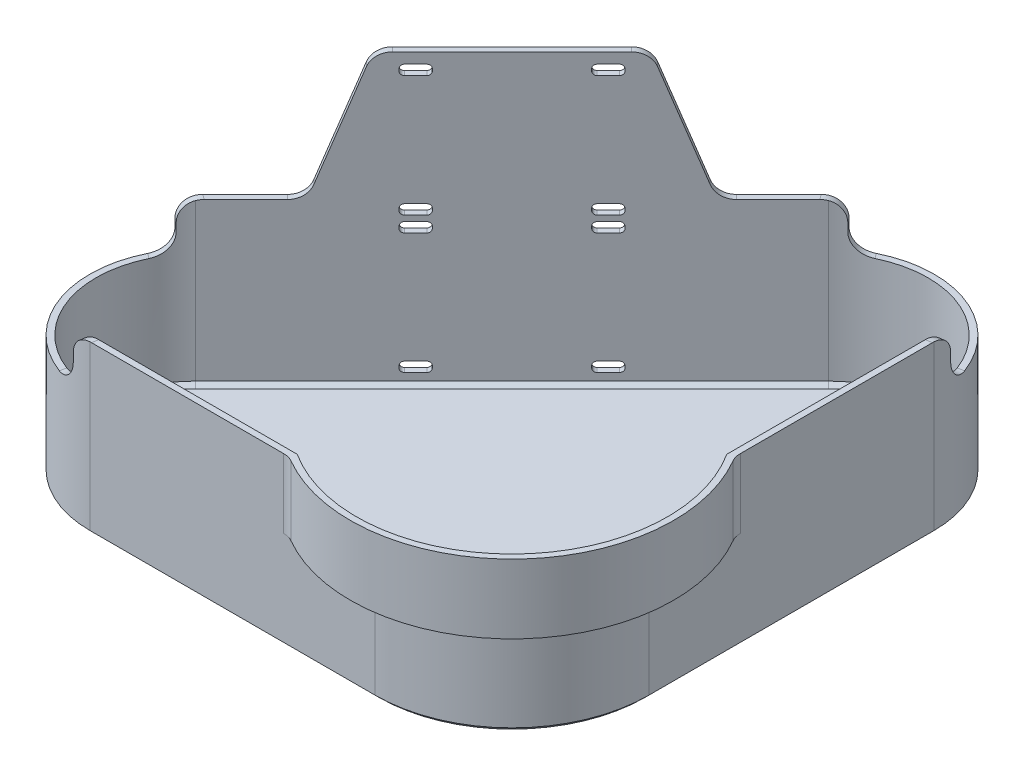
from build123d import *

# Parameters (mm, degrees)
BASE_EXTRUDE_R      = 2.15265
BOSS_EXTRUDE1_DEPTH = 2.000000064
EXTRUDE_THIN1_DEPTH = 31.75
BOSS_EXTRUDE2_START = -2.000000064
BOSS_EXTRUDE2_DEPTH = 2.000000064
EXTRUDE_THIN2_DEPTH = 20.32
WRAP1_SECTION_W     = 2
WRAP1_SECTION_H     = 15.24
WRAP1_ANGLE         = 117.312331459
BOSS_EXTRUDE3_DEPTH = 2.000000064
FILLET1_R           = 6.35
CHAMFER1_SIZE       = 1.27
CUT_EXTRUDE2_REACH  = 193.327
SKETCH10_W          = 7.62
SKETCH10_H          = 3.175
FILLET2_R           = 1.27


with BuildPart() as part:
    # Base Extrude → Boss-Extrude1 (new body)
    with BuildSketch(Plane(origin=(0, 0, 0), x_dir=(1, 0, 0), z_dir=(0, 1, 0))):
        with BuildLine():
            Line((3.000000096, 41.275), (3.000000096, 133.35))
            ThreePointArc((3.000000096, 133.35), (-18.059754668, 164.86815034), (-55.237947908, 157.472947908))
            Line((-55.237947908, 157.472947908), (-157.472947908, 55.237947908))
            ThreePointArc((-157.472947908, 55.237947908), (-164.86815034, 18.059754668), (-133.35, -3.000000096))
            Line((-133.35, -3.000000096), (-41.275, -3.000000096))
            ThreePointArc((-41.275, -3.000000096), (-9.967847195, 9.967847195), (3.000000096, 41.275))
        make_face()
        with Locations(Location((-55.570521066, 30.714596432, 0), (0, 0, 270))):
            Circle(BASE_EXTRUDE_R, mode=Mode.SUBTRACT)
        with Locations(Location((-30.714596432, 30.714596432, 0), (0, 0, 270))):
            Circle(BASE_EXTRUDE_R, mode=Mode.SUBTRACT)
        with Locations(Location((-30.714596432, 55.570521066, 0), (0, 0, 270))):
            Circle(BASE_EXTRUDE_R, mode=Mode.SUBTRACT)
    extrude(amount=BOSS_EXTRUDE1_DEPTH)

    # Sketch3 → Extrude-Thin1 (add)
    with BuildSketch(Plane(origin=(0, 2.000000064, 0), x_dir=(1, 0, 0), z_dir=(0, 1, 0))):
        with BuildLine():
            Line((-55.237947908, 157.472947908), (-157.472947908, 55.237947908))
            ThreePointArc((-157.472947908, 55.237947908), (-164.86815034, 18.059754668), (-133.35, -3.000000096))
            Line((-133.35, -3.000000096), (-41.275, -3.000000096))
            ThreePointArc((-41.275, -3.000000096), (-9.967847195, 9.967847195), (3.000000096, 41.275))
            Line((3.000000096, 41.275), (3.000000096, 133.35))
            ThreePointArc((3.000000096, 133.35), (-18.059754668, 164.86815034), (-55.237947908, 157.472947908))
        make_face()
        with BuildLine():
            Line((-53.8237343, 156.0587343), (-156.0587343, 53.8237343))
            ThreePointArc((-156.0587343, 53.8237343), (-163.020391216, 18.825121557), (-133.35, -1.000000032))
            Line((-133.35, -1.000000032), (-41.275, -1.000000032))
            ThreePointArc((-41.275, -1.000000032), (-11.382060803, 11.382060803), (1.000000032, 41.275))
            Line((1.000000032, 41.275), (1.000000032, 133.35))
            ThreePointArc((1.000000032, 133.35), (-18.825121557, 163.020391216), (-53.8237343, 156.0587343))
        make_face(mode=Mode.SUBTRACT)
    extrude(amount=EXTRUDE_THIN1_DEPTH)

    # Sketch4 → Boss-Extrude2 (add)
    with BuildSketch(Plane(origin=(0, 33.750000064, 0), x_dir=(1, 0, 0), z_dir=(0, 1, 0)).offset(BOSS_EXTRUDE2_START)):
        with BuildLine():
            Line((-41.275, -3.000000096), (-64.960850754, -3.000000096))
            ThreePointArc((-64.960850754, -3.000000096), (-5.769400727, 5.769400727), (3.000000096, 64.960850754))
            Line((3.000000096, 64.960850754), (3.000000096, 41.275))
            ThreePointArc((3.000000096, 41.275), (-9.967847195, 9.967847195), (-41.275, -3.000000096))
        make_face()
        with BuildLine():
            Line((-64.960850754, -3.000000096), (-68.94934792, -3.000000096))
            ThreePointArc((-68.94934792, -3.000000096), (-4.355187119, 4.355187119), (3.000000096, 68.94934792))
            Line((3.000000096, 68.94934792), (3.000000096, 64.960850754))
            ThreePointArc((3.000000096, 64.960850754), (-5.769400727, 5.769400727), (-64.960850754, -3.000000096))
        make_face()
    extrude(amount=BOSS_EXTRUDE2_DEPTH)

    # Sketch5 → Extrude-Thin2 (add)
    with BuildSketch(Plane(origin=(0, 33.750000064, 0), x_dir=(1, 0, 0), z_dir=(0, 1, 0))):
        with BuildLine():
            Line((-55.237947908, 157.472947908), (-157.472947908, 55.237947908))
            ThreePointArc((-157.472947908, 55.237947908), (-164.86815034, 18.059754668), (-133.35, -3.000000096))
            Line((-133.35, -3.000000096), (-68.94934792, -3.000000096))
            ThreePointArc((-68.94934792, -3.000000096), (-4.355187119, 4.355187119), (3.000000096, 68.94934792))
            Line((3.000000096, 68.94934792), (3.000000096, 133.35))
            ThreePointArc((3.000000096, 133.35), (-18.059754668, 164.86815034), (-55.237947908, 157.472947908))
        make_face()
        with BuildLine():
            Line((-53.8237343, 156.0587343), (-156.0587343, 53.8237343))
            ThreePointArc((-156.0587343, 53.8237343), (-163.020391216, 18.825121557), (-133.35, -1.000000032))
            Line((-133.35, -1.000000032), (-68.369640277, -1.000000032))
            ThreePointArc((-68.369640277, -1.000000032), (-5.769400727, 5.769400727), (1.000000032, 68.369640277))
            Line((1.000000032, 68.369640277), (1.000000032, 133.35))
            ThreePointArc((1.000000032, 133.35), (-18.825121557, 163.020391216), (-53.8237343, 156.0587343))
        make_face(mode=Mode.SUBTRACT)
    extrude(amount=EXTRUDE_THIN2_DEPTH)

    # Wrap1 section (on wrap section) → Wrap1 (revolve, cut)
    with BuildSketch(Plane(origin=(-133.35, 0, -31.115), x_dir=(-0.170521550427512, 0, 0.9853539469854462), z_dir=(0.9853539469854462, 0, 0.170521550427512))):
        with Locations((33.115000096, -46.4500001)):
            Rectangle(WRAP1_SECTION_W, WRAP1_SECTION_H)
    revolve(axis=Axis((-133.35, 0, -31.115), (0, -1, 0)), revolution_arc=WRAP1_ANGLE, mode=Mode.SUBTRACT)

    # SurfaceCut1
    split(bisect_by=Plane(origin=(0, 0, 0), x_dir=(-0.7071067811865477, 0, -0.7071067811865475), z_dir=(0.7071067811865475, 0, -0.7071067811865477)), keep=Keep.BOTTOM)

    # Mirror6: part across plane


with BuildPart() as part_1:
    add(part.part)
    add(part.part.mirror(Plane(origin=(0, 0, 0), x_dir=(0.7071067811865478, 0, 0.7071067811865472), z_dir=(0.7071067811865475, 0, -0.7071067811865477))))

    # Sketch9 → Boss-Extrude3 (add)
    with BuildSketch(Plane(origin=(-106.355447908, 0, -106.355447908), x_dir=(-0.7071067811865475, 0, 0.7071067811865477), z_dir=(-0.7071067811865477, 0, -0.7071067811865475))):
        Polygon((0, 54.070000064), (46.772871419, 54.070000064), (31.75, 95.345000064), (0, 95.345000064), align=None)
        Polygon((-46.772871419, 54.070000064), (0, 54.070000064), (0, 95.345000064), (-31.75, 95.345000064), align=None)
    extrude(amount=-BOSS_EXTRUDE3_DEPTH)

    # Fillet1
    fillet1_edges = [part_1.edges().sort_by_distance(p)[0] for p in [
        (-138.996821159, 54.0700001, 1.514996049),
        (-159.75136321, 54.0700001, -51.104278427),
        (-159.75136321, 38.8300001, -51.104278427),
        (-138.996821159, 38.8300001, 1.514996049),
        (3.000000096, 42.910000032, -68.94934792),
        (-51.104278427, 54.0700001, -159.75136321),
        (1.514996049, 54.0700001, -138.996821159),
        (-51.104278427, 38.8300001, -159.75136321),
        (1.514996049, 38.8300001, -138.996821159),
        (-83.197700802, 95.345000064, -128.098981407),
        (-128.098981407, 95.345000064, -83.197700802),
        (-138.72175566, 54.070000064, -72.574926548),
        (-72.574926548, 54.070000064, -138.72175566),
        (-68.94934792, 42.910000032, 3.000000096),
    ]]
    fillet(fillet1_edges, radius=FILLET1_R)

    # Chamfer1
    chamfer1_edges = [part_1.edges().sort_by_distance(p)[0] for p in [
        (-104.9412343, 2.000000064, -104.9412343),
        (-106.355447908, 0, -106.355447908),
        (-18.059754668, 0, -164.86815034),
        (3.000000096, 0, -87.3125),
        (-18.825121557, 2.000000064, -163.020391216),
        (1.000000032, 2.000000064, -87.3125),
        (-163.020391216, 2.000000064, -18.825121557),
        (-87.3125, 2.000000064, 1.000000032),
        (-11.382060803, 2.000000064, -11.382060803),
        (-9.967847195, 0, -9.967847195),
        (-87.3125, 0, 3.000000096),
        (-164.86815034, 0, -18.059754668),
    ]]
    chamfer(chamfer1_edges, length=CHAMFER1_SIZE)

    # Sketch10 → Cut-Extrude2 (cut, up to next)
    with BuildSketch(Plane(origin=(-106.355447908, 0, -106.355447908), x_dir=(-0.7071067811865475, 0, 0.7071067811865477), z_dir=(-0.7071067811865477, 0, -0.7071067811865475)), mode=Mode.PRIVATE) as cut_extrude2_sk1:
        with Locations((22, 7.26773328)):
            Rectangle(SKETCH10_W, SKETCH10_H)
    cut_extrude2_tool1 = extrude(cut_extrude2_sk1.sketch, amount=-CUT_EXTRUDE2_REACH, mode=Mode.PRIVATE) & part_1.part
    # Sketch10 → Cut-Extrude2 (cut, up to next)
    with BuildSketch(Plane(origin=(-106.355447908, 0, -106.355447908), x_dir=(-0.7071067811865475, 0, 0.7071067811865477), z_dir=(-0.7071067811865477, 0, -0.7071067811865475)), mode=Mode.PRIVATE) as cut_extrude2_sk2:
        with Locations((-22, 7.26773328)):
            Rectangle(SKETCH10_W, SKETCH10_H)
    cut_extrude2_tool2 = extrude(cut_extrude2_sk2.sketch, amount=-CUT_EXTRUDE2_REACH, mode=Mode.PRIVATE) & part_1.part
    # Sketch10 → Cut-Extrude2 (cut, up to next)
    with BuildSketch(Plane(origin=(-106.355447908, 0, -106.355447908), x_dir=(-0.7071067811865475, 0, 0.7071067811865477), z_dir=(-0.7071067811865477, 0, -0.7071067811865475)), mode=Mode.PRIVATE) as cut_extrude2_sk3:
        with Locations((-22, 46.28226672)):
            Rectangle(SKETCH10_W, SKETCH10_H)
    cut_extrude2_tool3 = extrude(cut_extrude2_sk3.sketch, amount=-CUT_EXTRUDE2_REACH, mode=Mode.PRIVATE) & part_1.part
    # Sketch10 → Cut-Extrude2 (cut, up to next)
    with BuildSketch(Plane(origin=(-106.355447908, 0, -106.355447908), x_dir=(-0.7071067811865475, 0, 0.7071067811865477), z_dir=(-0.7071067811865477, 0, -0.7071067811865475)), mode=Mode.PRIVATE) as cut_extrude2_sk4:
        with Locations((22, 46.28226672)):
            Rectangle(SKETCH10_W, SKETCH10_H)
    cut_extrude2_tool4 = extrude(cut_extrude2_sk4.sketch, amount=-CUT_EXTRUDE2_REACH, mode=Mode.PRIVATE) & part_1.part
    # Sketch10 → Cut-Extrude2 (cut, up to next)
    with BuildSketch(Plane(origin=(-106.355447908, 0, -106.355447908), x_dir=(-0.7071067811865475, 0, 0.7071067811865477), z_dir=(-0.7071067811865477, 0, -0.7071067811865475)), mode=Mode.PRIVATE) as cut_extrude2_sk5:
        with Locations((22, 51.29273328)):
            Rectangle(SKETCH10_W, SKETCH10_H)
    cut_extrude2_tool5 = extrude(cut_extrude2_sk5.sketch, amount=-CUT_EXTRUDE2_REACH, mode=Mode.PRIVATE) & part_1.part
    # Sketch10 → Cut-Extrude2 (cut, up to next)
    with BuildSketch(Plane(origin=(-106.355447908, 0, -106.355447908), x_dir=(-0.7071067811865475, 0, 0.7071067811865477), z_dir=(-0.7071067811865477, 0, -0.7071067811865475)), mode=Mode.PRIVATE) as cut_extrude2_sk6:
        with Locations((-22, 51.29273328)):
            Rectangle(SKETCH10_W, SKETCH10_H)
    cut_extrude2_tool6 = extrude(cut_extrude2_sk6.sketch, amount=-CUT_EXTRUDE2_REACH, mode=Mode.PRIVATE) & part_1.part
    # Sketch10 → Cut-Extrude2 (cut, up to next)
    with BuildSketch(Plane(origin=(-106.355447908, 0, -106.355447908), x_dir=(-0.7071067811865475, 0, 0.7071067811865477), z_dir=(-0.7071067811865477, 0, -0.7071067811865475)), mode=Mode.PRIVATE) as cut_extrude2_sk7:
        with Locations((-22, 90.30726672)):
            Rectangle(SKETCH10_W, SKETCH10_H)
    cut_extrude2_tool7 = extrude(cut_extrude2_sk7.sketch, amount=-CUT_EXTRUDE2_REACH, mode=Mode.PRIVATE) & part_1.part
    # Sketch10 → Cut-Extrude2 (cut, up to next)
    with BuildSketch(Plane(origin=(-106.355447908, 0, -106.355447908), x_dir=(-0.7071067811865475, 0, 0.7071067811865477), z_dir=(-0.7071067811865477, 0, -0.7071067811865475)), mode=Mode.PRIVATE) as cut_extrude2_sk8:
        with Locations((22, 90.30726672)):
            Rectangle(SKETCH10_W, SKETCH10_H)
    cut_extrude2_tool8 = extrude(cut_extrude2_sk8.sketch, amount=-CUT_EXTRUDE2_REACH, mode=Mode.PRIVATE) & part_1.part
    add(cut_extrude2_tool1.solids().sort_by_distance((-121.911797, 7.267733, -90.799099))[0], mode=Mode.SUBTRACT)
    add(cut_extrude2_tool2.solids().sort_by_distance((-90.799099, 7.267733, -121.911797))[0], mode=Mode.SUBTRACT)
    add(cut_extrude2_tool3.solids().sort_by_distance((-90.799099, 46.282267, -121.911797))[0], mode=Mode.SUBTRACT)
    add(cut_extrude2_tool4.solids().sort_by_distance((-121.911797, 46.282267, -90.799099))[0], mode=Mode.SUBTRACT)
    add(cut_extrude2_tool5.solids().sort_by_distance((-121.911797, 51.292733, -90.799099))[0], mode=Mode.SUBTRACT)
    add(cut_extrude2_tool6.solids().sort_by_distance((-90.799099, 51.292733, -121.911797))[0], mode=Mode.SUBTRACT)
    add(cut_extrude2_tool7.solids().sort_by_distance((-90.799099, 90.307267, -121.911797))[0], mode=Mode.SUBTRACT)
    add(cut_extrude2_tool8.solids().sort_by_distance((-121.911797, 90.307267, -90.799099))[0], mode=Mode.SUBTRACT)

    # Fillet2
    fillet2_edges = [part_1.edges().sort_by_distance(p)[0] for p in [
        (-92.786068754, 5.68023328, -118.510613454),
        (-92.786068754, 8.85523328, -118.510613454),
        (-87.397915082, 8.85523328, -123.898767127),
        (-87.397915082, 5.68023328, -123.898767127),
        (-87.397915082, 47.86976672, -123.898767127),
        (-92.786068754, 47.86976672, -118.510613454),
        (-92.786068754, 44.69476672, -118.510613454),
        (-87.397915082, 44.69476672, -123.898767127),
        (-123.898767127, 47.86976672, -87.397915082),
        (-123.898767127, 44.69476672, -87.397915082),
        (-118.510613454, 44.69476672, -92.786068754),
        (-118.510613454, 47.86976672, -92.786068754),
        (-123.898767127, 49.70523328, -87.397915082),
        (-118.510613454, 49.70523328, -92.786068754),
        (-118.510613454, 52.88023328, -92.786068754),
        (-123.898767127, 52.88023328, -87.397915082),
        (-87.397915082, 49.70523328, -123.898767127),
        (-87.397915082, 52.88023328, -123.898767127),
        (-92.786068754, 52.88023328, -118.510613454),
        (-92.786068754, 49.70523328, -118.510613454),
        (-87.397915082, 91.89476672, -123.898767127),
        (-92.786068754, 91.89476672, -118.510613454),
        (-92.786068754, 88.71976672, -118.510613454),
        (-87.397915082, 88.71976672, -123.898767127),
        (-123.898767127, 91.89476672, -87.397915082),
        (-123.898767127, 88.71976672, -87.397915082),
        (-118.510613454, 88.71976672, -92.786068754),
        (-118.510613454, 91.89476672, -92.786068754),
        (-118.510613454, 8.85523328, -92.786068754),
        (-118.510613454, 5.68023328, -92.786068754),
        (-123.898767127, 5.68023328, -87.397915082),
        (-123.898767127, 8.85523328, -87.397915082),
    ]]
    fillet(fillet2_edges, radius=FILLET2_R)


solid = part_1.part
